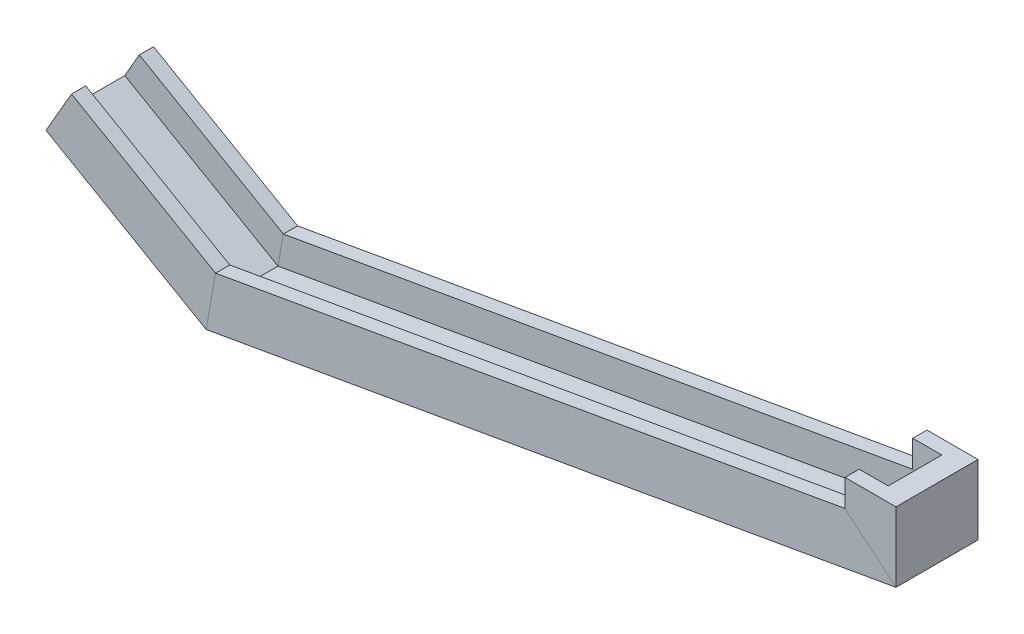
from build123d import *


with BuildPart() as part:
    # 扫描2: sweep along a path in 草图2
    with BuildLine(Plane(origin=(0, 0, -16.268170321), x_dir=(-1, 0, 0), z_dir=(0, 0, -1))) as sweep_2_path:
        Line((18.693353683, 0), (18.693353683, -10))
        Line((18.693353683, -10), (148.693353683, -32.922507492))
        Line((148.693353683, -32.922507492), (178.693353683, -15.601999416))
    # 草图1 → 扫描2 (sweep)
    with BuildSketch(Plane(origin=(0, 0, 0), x_dir=(1, 0, 0), z_dir=(0, 1, 0))):
        Polygon((-24.333441136, 21.518170321), (-24.333441136, 24.303170321), (-14.333441136, 24.303170321), (-14.333441136, 8.233170321), (-24.333441136, 8.233170321), (-24.333441136, 11.018170321), (-18.640334153, 11.018170321), (-18.640334153, 21.518170321), align=None)
    sweep(path=sweep_2_path.line, transition=Transition.RIGHT)


solid = part.part
